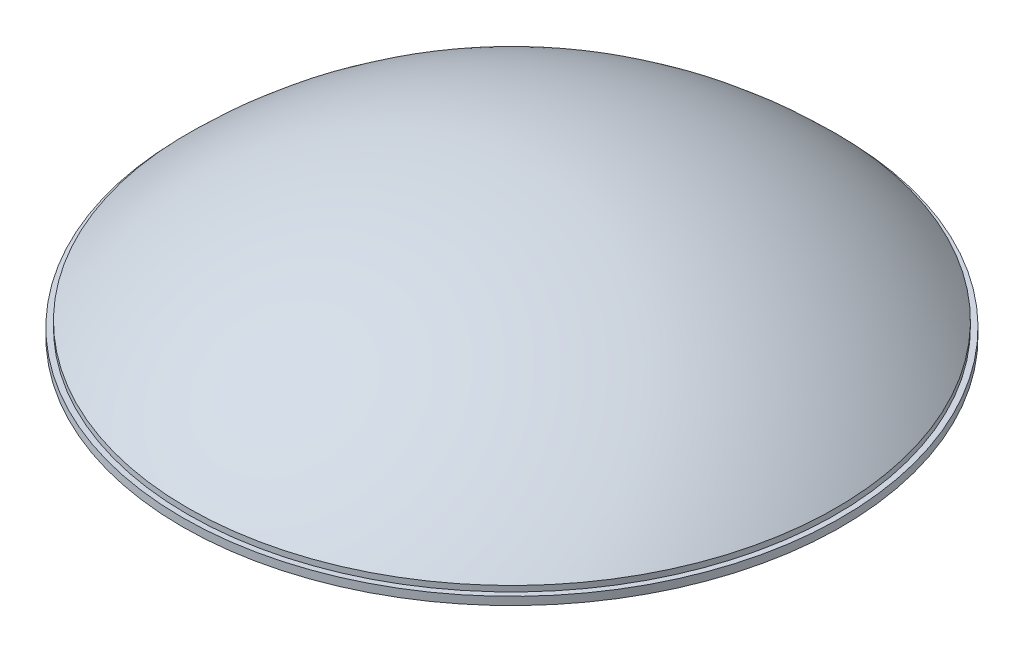
from build123d import *


with BuildPart() as part:
    # Sketch2 → Revolve1 (revolve)
    with BuildSketch(Plane(origin=(0, 0, 0), x_dir=(0, 0, -1), z_dir=(1, 0, 0)), mode=Mode.PRIVATE) as revolve1_sk:
        with BuildLine():
            Line((246.5, 236.958329575), (242.5, 236.958329575))
            Line((242.5, 236.958329575), (242.5, 241.159179796))
            ThreePointArc((242.5, 241.159179796), (131.315575066, 315.785084741), (0, 342))
            Line((0, 342), (0, 332))
            ThreePointArc((0, 332), (129.51029801, 305.69769824), (238.5, 230.958329575))
            Line((238.5, 230.958329575), (246.5, 230.958329575))
            Line((246.5, 230.958329575), (246.5, 236.958329575))
        make_face()
    revolve(revolve1_sk.sketch.rotate(Axis((0, 342, 0), (0, -1, 0)), 180), axis=Axis((0, 342, 0), (0, -1, 0)))


solid = part.part
